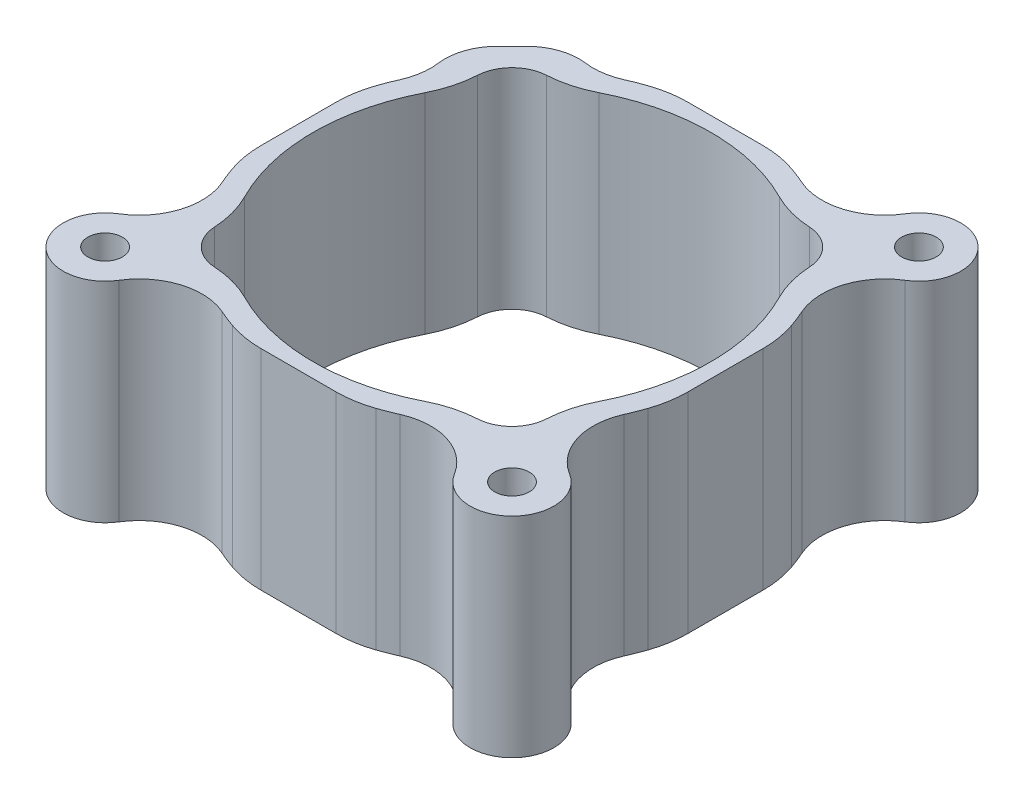
from build123d import *

# Parameters (mm, degrees)
SKETCH_1_R          = 1.65
EXTRUDE_1_DEPTH     = 20
CUT_EXTRUDE_START   = -15
SKETCH_4_R          = 1.65
CUT_EXTRUDE_1_DEPTH = 15
FILLET_1_R          = 10
FILLET_2_R          = 5


with BuildPart() as part:
    # ｽｹｯﾁ1 → ﾎﾞｽ - 押し出し1 (new body)
    with BuildSketch(Plane(origin=(0, 0, 0), x_dir=(1, 0, 0), z_dir=(0, 1, 0))):
        with BuildLine():
            Line((20.396078054, 5), (20.396078054, -5))
            ThreePointArc((20.396078054, -5), (19.876430019, -6.776985295), (19.202290705, -8.501295883))
            ThreePointArc((19.202290705, -8.501295883), (18.958497792, -12.709351685), (21.542725681, -16.039356915))
            ThreePointArc((21.542725681, -16.039356915), (22.273863607, -22.273863607), (16.039356915, -21.542725681))
            ThreePointArc((16.039356915, -21.542725681), (12.709351685, -18.958497792), (8.501295883, -19.202290705))
            ThreePointArc((8.501295883, -19.202290705), (6.776985295, -19.876430019), (5, -20.396078054))
            Line((5, -20.396078054), (-5, -20.396078054))
            ThreePointArc((-5, -20.396078054), (-6.776985295, -19.876430019), (-8.501295883, -19.202290705))
            ThreePointArc((-8.501295883, -19.202290705), (-12.709351685, -18.958497792), (-16.039356915, -21.542725681))
            ThreePointArc((-16.039356915, -21.542725681), (-22.273863607, -22.273863607), (-21.542725681, -16.039356915))
            ThreePointArc((-21.542725681, -16.039356915), (-18.958497792, -12.709351685), (-19.202290705, -8.501295883))
            ThreePointArc((-19.202290705, -8.501295883), (-19.876430019, -6.776985295), (-20.396078054, -5))
            Line((-20.396078054, -5), (-20.396078054, 5))
            ThreePointArc((-20.396078054, 5), (-19.876430019, 6.776985295), (-19.202290705, 8.501295883))
            ThreePointArc((-19.202290705, 8.501295883), (-18.958497792, 12.709351685), (-21.542725681, 16.039356915))
            ThreePointArc((-21.542725681, 16.039356915), (-22.273863607, 22.273863607), (-16.039356915, 21.542725681))
            ThreePointArc((-16.039356915, 21.542725681), (-12.709351685, 18.958497792), (-8.501295883, 19.202290705))
            ThreePointArc((-8.501295883, 19.202290705), (-6.776985295, 19.876430019), (-5, 20.396078054))
            Line((-5, 20.396078054), (5, 20.396078054))
            ThreePointArc((5, 20.396078054), (6.776985295, 19.876430019), (8.501295883, 19.202290705))
            ThreePointArc((8.501295883, 19.202290705), (12.709351685, 18.958497792), (16.039356915, 21.542725681))
            ThreePointArc((16.039356915, 21.542725681), (22.273863607, 22.273863607), (21.542725681, 16.039356915))
            ThreePointArc((21.542725681, 16.039356915), (18.958497792, 12.709351685), (19.202290705, 8.501295883))
            ThreePointArc((19.202290705, 8.501295883), (19.876430019, 6.776985295), (20.396078054, 5))
        make_face()
        with Locations(Location((19.445436483, 19.445436483, 0), (0, 0, 270))):
            Circle(SKETCH_1_R, mode=Mode.SUBTRACT)
        with Locations(Location((19.445436483, -19.445436483, 0), (0, 0, 270))):
            Circle(SKETCH_1_R, mode=Mode.SUBTRACT)
        with Locations(Location((-19.445436483, -19.445436483, 0), (0, 0, 270))):
            Circle(SKETCH_1_R, mode=Mode.SUBTRACT)
        with Locations(Location((-19.445436483, 19.445436483, 0), (0, 0, 270))):
            Circle(SKETCH_1_R, mode=Mode.SUBTRACT)
        with BuildLine():
            ThreePointArc((10.911844504, 15.554152164), (0, 19), (-10.911844504, 15.554152164))
            ThreePointArc((-10.911844504, 15.554152164), (-14.849242405, 14.849242405), (-15.554152164, 10.911844504))
            ThreePointArc((-15.554152164, 10.911844504), (-19, 0), (-15.554152164, -10.911844504))
            ThreePointArc((-15.554152164, -10.911844504), (-14.849242405, -14.849242405), (-10.911844504, -15.554152164))
            ThreePointArc((-10.911844504, -15.554152164), (0, -19), (10.911844504, -15.554152164))
            ThreePointArc((10.911844504, -15.554152164), (14.849242405, -14.849242405), (15.554152164, -10.911844504))
            ThreePointArc((15.554152164, -10.911844504), (19, 0), (15.554152164, 10.911844504))
            ThreePointArc((15.554152164, 10.911844504), (14.849242405, 14.849242405), (10.911844504, 15.554152164))
        make_face(mode=Mode.SUBTRACT)
    extrude(amount=EXTRUDE_1_DEPTH)

    # ｽｹｯﾁ4 → ｶｯﾄ - 押し出し1 (cut)
    # profile 1 of 3: a face of its own
    with BuildSketch(Plane(origin=(0, 20, 0), x_dir=(1, 0, 0), z_dir=(0, 1, 0)).offset(CUT_EXTRUDE_START)):
        with BuildLine():
            ThreePointArc((-21.542725681, 16.039356915), (-20.338354704, 15.06240992), (-19.424600386, 13.80941833))
            Line((-19.424600386, 13.80941833), (-16.617009355, 16.617009361))
            ThreePointArc((-16.617009355, 16.617009361), (-18.979538151, 15.472661792), (-21.542725681, 16.039356915))
        make_face()
    # profile 2 of 3: a face of its own
    with BuildSketch(Plane(origin=(0, 20, 0), x_dir=(1, 0, 0), z_dir=(0, 1, 0)).offset(CUT_EXTRUDE_START)):
        with BuildLine():
            ThreePointArc((-21.542725681, 16.039356915), (-18.979538151, 15.472661792), (-16.617009355, 16.617009361))
            ThreePointArc((-16.617009355, 16.617009361), (-15.749918352, 17.914702755), (-15.445436483, 19.445436483))
            ThreePointArc((-15.445436483, 19.445436483), (-15.596779686, 20.535317607), (-16.039356915, 21.542725681))
            ThreePointArc((-16.039356915, 21.542725681), (-22.273863607, 22.273863607), (-21.542725681, 16.039356915))
        make_face()
        with Locations(Location((-19.445436483, 19.445436483, 0), (0, 0, 270))):
            Circle(SKETCH_4_R, mode=Mode.SUBTRACT)
    # profile 3 of 3: a face of its own
    with BuildSketch(Plane(origin=(0, 20, 0), x_dir=(1, 0, 0), z_dir=(0, 1, 0)).offset(CUT_EXTRUDE_START)):
        with BuildLine():
            ThreePointArc((-15.445436483, 19.445436483), (-15.749918352, 17.914702755), (-16.617009355, 16.617009361))
            Line((-16.617009355, 16.617009361), (-13.80941833, 19.424600386))
            ThreePointArc((-13.80941833, 19.424600386), (-15.06240992, 20.338354704), (-16.039356915, 21.542725681))
            ThreePointArc((-16.039356915, 21.542725681), (-15.596779686, 20.535317607), (-15.445436483, 19.445436483))
        make_face()
    extrude(amount=CUT_EXTRUDE_1_DEPTH, mode=Mode.SUBTRACT)

    # ﾌｨﾚｯﾄ1
    fillet_1_edges = [part.edges().sort_by_distance(p)[0] for p in [
        (20.396078054, 10, -5),
        (20.396078054, 10, 5),
        (5, 10, 20.396078054),
        (-5, 10, 20.396078054),
        (-20.396078054, 10, 5),
        (-20.396078054, 10, -5),
        (-5, 10, -20.396078054),
        (5, 10, -20.396078054),
        (15.554152164, 10, -10.911844504),
        (10.911844504, 10, -15.554152164),
        (-10.911844504, 10, -15.554152164),
        (-15.554152164, 10, -10.911844504),
        (-15.554152164, 10, 10.911844504),
        (-10.911844504, 10, 15.554152164),
        (10.911844504, 10, 15.554152164),
        (15.554152164, 10, 10.911844504),
    ]]
    fillet(fillet_1_edges, radius=FILLET_1_R)

    # ﾌｨﾚｯﾄ2
    fillet_2_edges = [part.edges().sort_by_distance(p)[0] for p in [
        (-13.80941833, 12.5, -19.424600386),
        (-19.424600386, 12.5, -13.80941833),
    ]]
    fillet(fillet_2_edges, radius=FILLET_2_R)


solid = part.part
